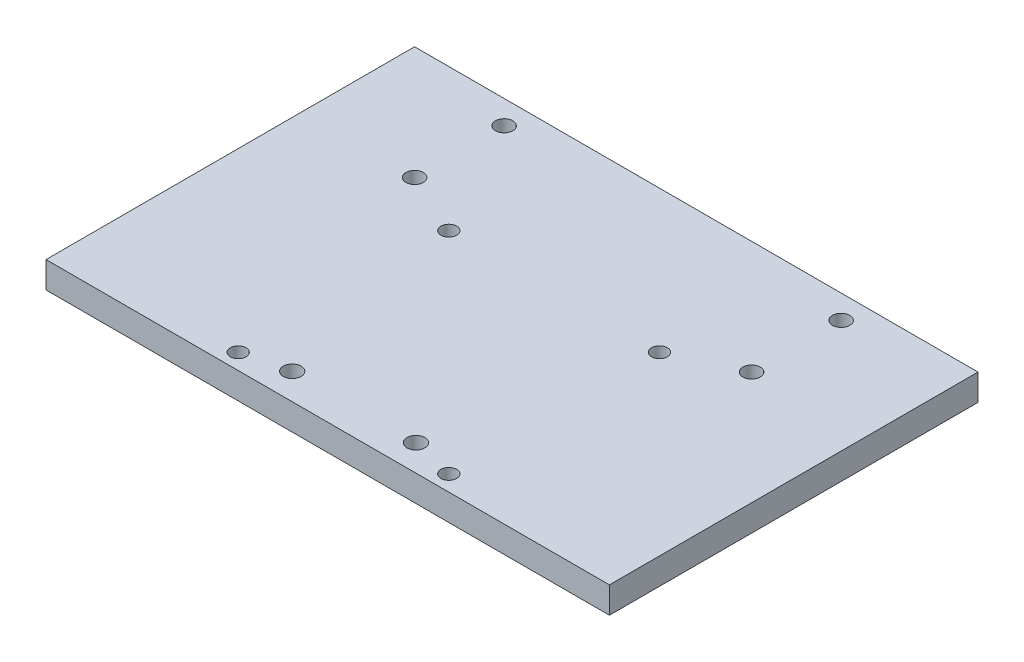
from build123d import *

# Parameters (mm, degrees)
SKETCH_1_W          = 107
SKETCH_1_H          = 70
EXTRUDE_1_DEPTH     = 5
SKETCH_2_R          = 1.7
SKETCH_2_R_2        = 1.65
SKETCH_2_R_3        = 1.5
CUT_EXTRUDE_1_DEPTH = 5


with BuildPart() as part:
    # 草图1 → 凸台-拉伸1 (new body)
    with BuildSketch(Plane(origin=(0, 0, 0), x_dir=(1, 0, 0), z_dir=(0, 1, 0))):
        with Locations((2.807580175, -14.489067055)):
            Rectangle(SKETCH_1_W, SKETCH_1_H)
    extrude(amount=EXTRUDE_1_DEPTH)

    # 草图2 → 切除-拉伸1 (cut)
    with BuildSketch(Plane.XZ):
        with Locations(Location((-8.942419825, 44.489067055, 0), (0, 0, 270))):
            Circle(SKETCH_2_R)
        with Locations(Location((-29.192419825, -16.010932945, 0), (0, 0, 270))):
            Circle(SKETCH_2_R_2)
        with Locations(Location((-29.192419825, 0.989067055, 0), (0, 0, 90))):
            Circle(SKETCH_2_R_2)
        with Locations(Location((14.557580175, 44.489067055, 0), (0, 0, 90))):
            Circle(SKETCH_2_R)
        with Locations(Location((34.807580175, -16.010932945, 0), (0, 0, 90))):
            Circle(SKETCH_2_R_2)
        with Locations(Location((34.807580175, 0.989067055, 0), (0, 0, 270))):
            Circle(SKETCH_2_R_2)
        with Locations(Location((-17.192419825, 46.489067055, 0), (0, 0, 270))):
            Circle(SKETCH_2_R_3)
        with Locations(Location((-17.192419825, 6.489067055, 0), (0, 0, 90))):
            Circle(SKETCH_2_R_3)
        with Locations(Location((22.807580175, 46.489067055, 0), (0, 0, 90))):
            Circle(SKETCH_2_R_3)
        with Locations(Location((22.807580175, 6.489067055, 0), (0, 0, 270))):
            Circle(SKETCH_2_R_3)
    extrude(amount=-CUT_EXTRUDE_1_DEPTH, mode=Mode.SUBTRACT)


solid = part.part
